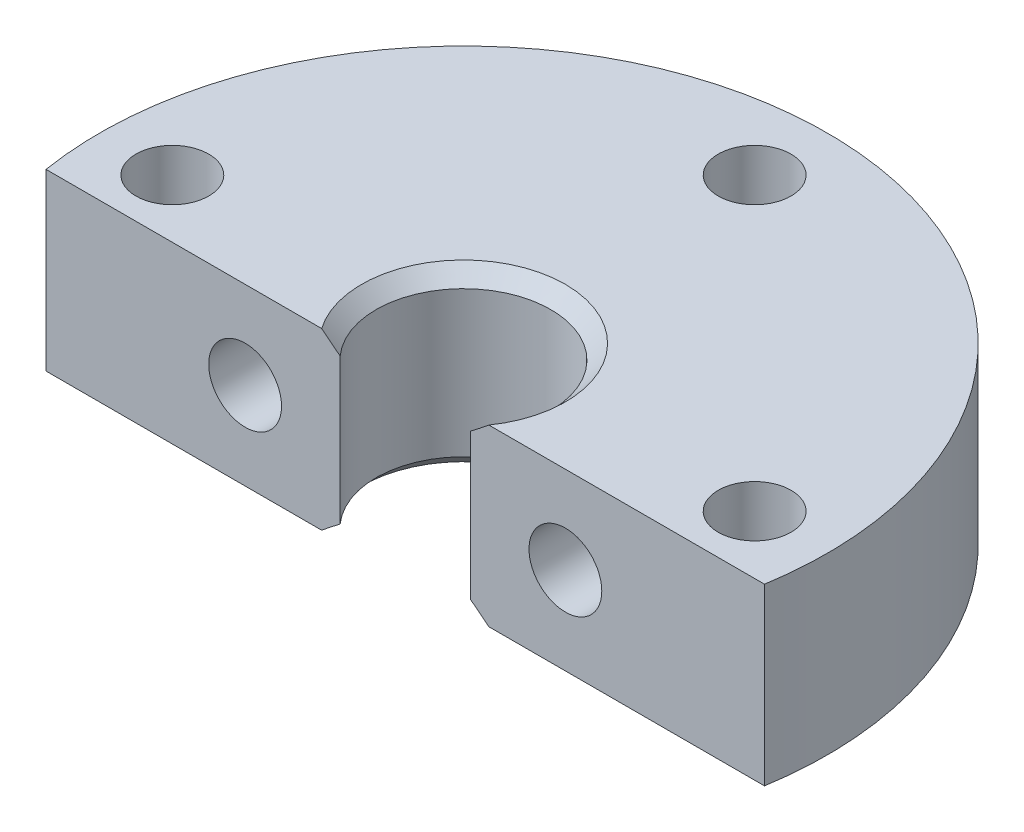
from build123d import *

# Parameters (mm, degrees)
SKETCH_1_R               = 12.5
SKETCH_1_R_2             = 3
EXTRUDE_1_DEPTH          = 3
HOLE_WIZARD_M3_2_D       = 2.5
CUT_EXTRUDE_1_DEPTH      = 19.668154703
CUT_EXTRUDE_1_DEPTH_BACK = 19.668154703
HOLE_WIZARD_M3_1_D       = 2.5
CHAMFER_1_SIZE           = 0.5


with BuildPart() as part:
    # 草图1 → 凸台-拉伸1 (new, symmetric)
    with BuildSketch(Plane(origin=(0, 0, 0), x_dir=(1, 0, 0), z_dir=(0, 1, 0))):
        with Locations(Location((0, 0, 0), (0, 0, 270))):
            Circle(SKETCH_1_R)
        with Locations(Location((0, 0, 0), (0, 0, 270))):
            Circle(SKETCH_1_R_2, mode=Mode.SUBTRACT)
    extrude(amount=EXTRUDE_1_DEPTH, both=True)

    # M3 螺纹孔2 (through all)
    with Locations(Plane(origin=(0, 3, -10), x_dir=(0, 0, 1), z_dir=(0, 1, 0))):
        with Locations((0, 0), (10, 10), (20, 0), (10, -10)):
            Hole(HOLE_WIZARD_M3_2_D / 2)

    # 草图4 → 切除-拉伸1 (cut, two sides: drawn at the far end of the back side and taken through both)
    with BuildSketch(Plane(origin=(0, 3, 0), x_dir=(1, 0, 0), z_dir=(0, 1, 0)).offset(-CUT_EXTRUDE_1_DEPTH_BACK)):
        Polygon((-79.861969102, -2), (-12.338962679, -2), (12.338962679, -2), (79.861969102, -2), (79.861969102, -137.046012846), (-79.861969102, -137.046012846), align=None)
    extrude(amount=CUT_EXTRUDE_1_DEPTH + CUT_EXTRUDE_1_DEPTH_BACK, mode=Mode.SUBTRACT)

    # M3 螺纹孔1 (through all)
    with Locations(Plane(origin=(-5.5, 0, 2), x_dir=(1, 0, 0), z_dir=(0, 0, 1))):
        with Locations((0, 0), (11, 0)):
            Hole(HOLE_WIZARD_M3_1_D / 2)

    # 倒角1
    chamfer_1_edges = [part.edges().sort_by_distance(p)[0] for p in [
        (0, -3, -3),
        (0, 3, -3),
    ]]
    chamfer(chamfer_1_edges, length=CHAMFER_1_SIZE)


solid = part.part
